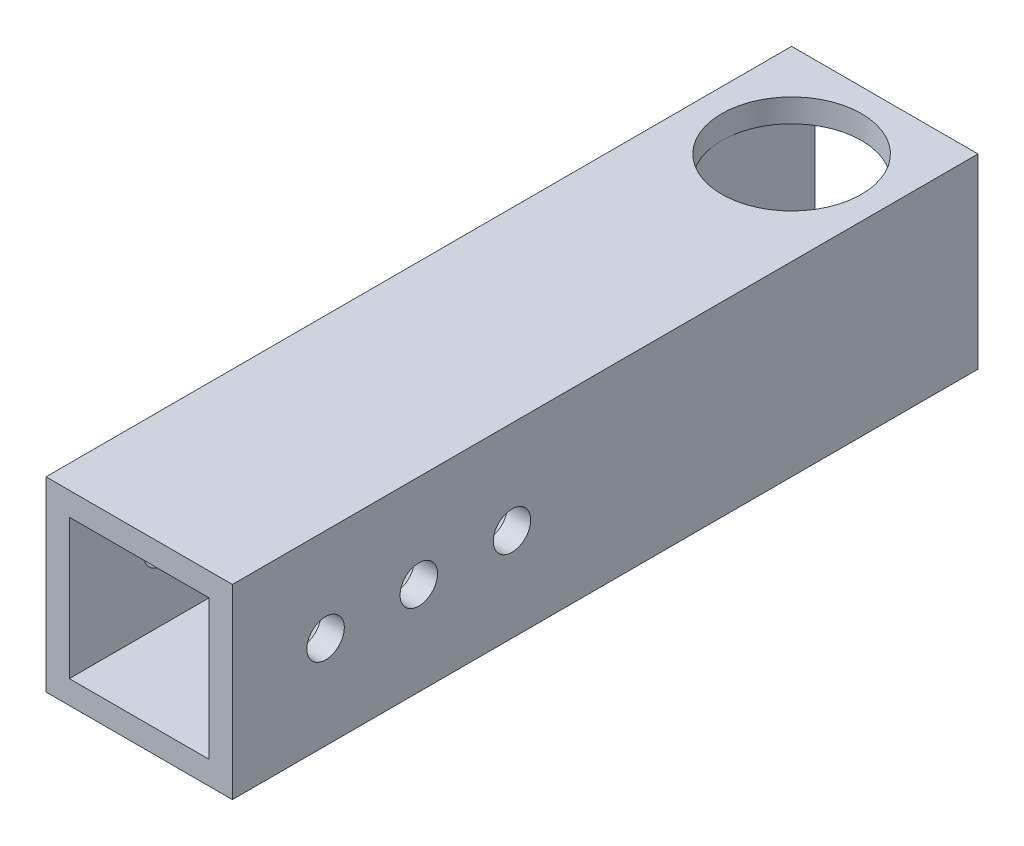
from build123d import *

# Parameters (mm, degrees)
SKETCH1_W              = 25.4
SKETCH1_H              = 25.4
SKETCH1_W_2            = 19.05
SKETCH1_H_2            = 19.05
EXTRUDE_THIN1_DEPTH    = 101.6
SKETCH2_R              = 9.525
CUT_EXTRUDE1_DEPTH     = 108.763073453
F_10_CLEARANCE_HOLE1_D = 5.1054


with BuildPart() as part:
    # Sketch1 → Extrude-Thin1 (new body)
    with BuildSketch(Plane.XY):
        with Locations((-12.7, 12.7)):
            Rectangle(SKETCH1_W, SKETCH1_H)
        with Locations((-12.7, 12.7)):
            Rectangle(SKETCH1_W_2, SKETCH1_H_2, mode=Mode.SUBTRACT)
    extrude(amount=EXTRUDE_THIN1_DEPTH)

    # Sketch2 → Cut-Extrude1 (cut, through all)
    with BuildSketch(Plane(origin=(0, 0, 0), x_dir=(-1, 0, 0), z_dir=(0, -1, 0))):
        with Locations(Location((12.7, -12.7, 0), (0, 0, 90))):
            Circle(SKETCH2_R)
    extrude(amount=-CUT_EXTRUDE1_DEPTH, mode=Mode.SUBTRACT)

    # #10 Clearance Hole1 (through all)
    with Locations(Plane(origin=(0, 0, 0), x_dir=(0, 0, -1), z_dir=(1, 0, 0))):
        with Locations((-76.2, 12.7), (-88.9, 12.7), (-63.5, 12.7)):
            Hole(F_10_CLEARANCE_HOLE1_D / 2)


solid = part.part
